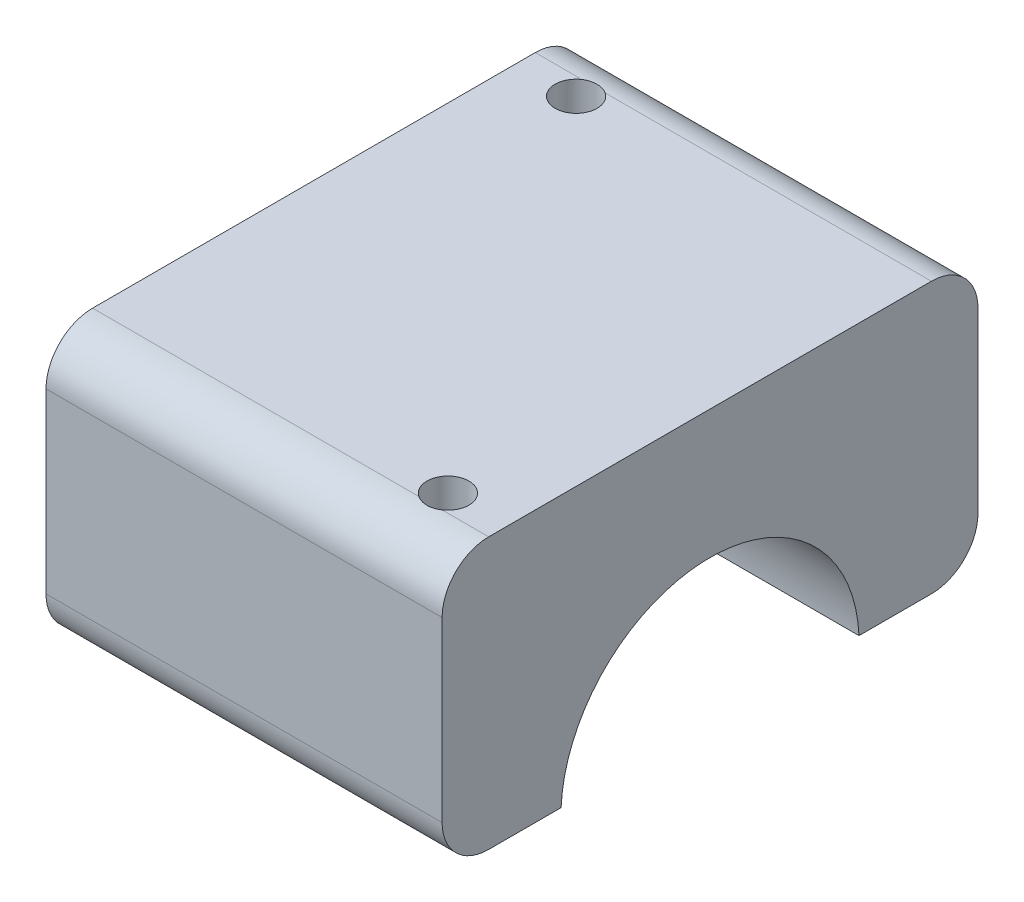
from build123d import *

# Parameters (mm, degrees)
BOSS_EXTRUDE1_DEPTH     = 17
CUT_EXTRUDE1_DEPTH      = 38.233662189
CUT_EXTRUDE1_DEPTH_BACK = 38.233662189
SKETCH2_R               = 12.8
SKETCH3_R               = 1.8
CUT_EXTRUDE2_DEPTH      = 23.84


with BuildPart() as part:
    # Sketch1 → Boss-Extrude1 (new, symmetric)
    with BuildSketch(Plane(origin=(0, 0, 0), x_dir=(0, 0, -1), z_dir=(1, 0, 0))):
        with BuildLine():
            Line((-19, 0.6), (19, 0.6))
            ThreePointArc((19, 0.6), (21.828427125, 1.771572875), (23, 4.6))
            Line((23, 4.6), (23, 19.84))
            ThreePointArc((23, 19.84), (21.828427125, 22.668427125), (19, 23.84))
            Line((19, 23.84), (-19, 23.84))
            ThreePointArc((-19, 23.84), (-21.828427125, 22.668427125), (-23, 19.84))
            Line((-23, 19.84), (-23, 4.6))
            ThreePointArc((-23, 4.6), (-21.828427125, 1.771572875), (-19, 0.6))
        make_face()
    extrude(amount=BOSS_EXTRUDE1_DEPTH, both=True)

    # Sketch2 → Cut-Extrude1 (cut, two sides: drawn at the far end of the back side and taken through both)
    with BuildSketch(Plane(origin=(0, 0, 0), x_dir=(0, 0, -1), z_dir=(1, 0, 0)).offset(-CUT_EXTRUDE1_DEPTH_BACK)):
        Circle(SKETCH2_R)
    extrude(amount=CUT_EXTRUDE1_DEPTH + CUT_EXTRUDE1_DEPTH_BACK, mode=Mode.SUBTRACT)

    # Sketch3 → Cut-Extrude2 (cut)
    with BuildSketch(Plane(origin=(0, 0.6, 0), x_dir=(1, 0, 0), z_dir=(0, 1, 0))):
        with Locations(Location((12, -17.5, 0), (0, 0, 236.442690238))):
            Circle(SKETCH3_R)
        with Locations(Location((-12, 17.5, 0), (0, 0, 123.557309762))):
            Circle(SKETCH3_R)
    extrude(amount=CUT_EXTRUDE2_DEPTH, mode=Mode.SUBTRACT)


solid = part.part
